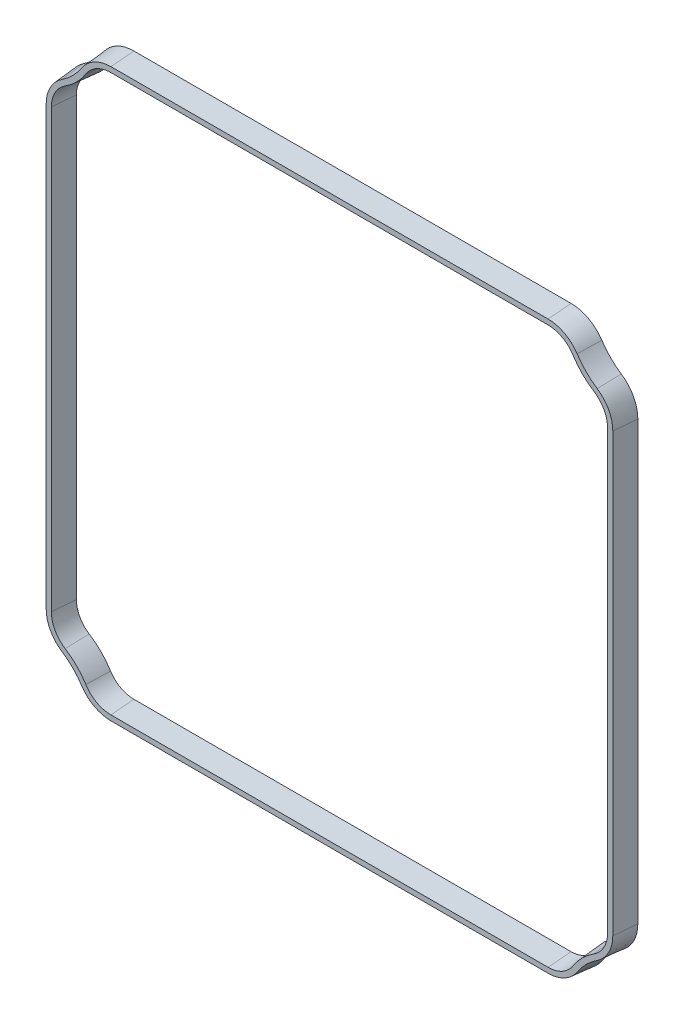
from build123d import *

# Parameters (mm, degrees)
BOSS_EXTRUDE1_DEPTH = 2.5
BOSS_EXTRUDE1_DRAFT = 5


with BuildPart() as part:
    # Sketch1 → Boss-Extrude1 (with draft: the straight prism first)
    with BuildSketch(Plane.XY):
        with BuildLine():
            Line((65.5, 11.25), (65.5, 58.75))
            ThreePointArc((65.5, 58.75), (65.023112089, 60.644117527), (63.706159397, 62.086594179))
            ThreePointArc((63.706159397, 62.086594179), (62.539407406, 63.039407406), (61.586594179, 64.206159397))
            ThreePointArc((61.586594179, 64.206159397), (60.144117527, 65.523112089), (58.25, 66))
            Line((58.25, 66), (10.75, 66))
            ThreePointArc((10.75, 66), (8.855882473, 65.523112089), (7.413405821, 64.206159397))
            ThreePointArc((7.413405821, 64.206159397), (6.460592594, 63.039407406), (5.293840603, 62.086594179))
            ThreePointArc((5.293840603, 62.086594179), (3.976887911, 60.644117527), (3.5, 58.75))
            Line((3.5, 58.75), (3.5, 11.25))
            ThreePointArc((3.5, 11.25), (3.976887911, 9.355882473), (5.293840603, 7.913405821))
            ThreePointArc((5.293840603, 7.913405821), (6.460592594, 6.960592594), (7.413405821, 5.793840603))
            ThreePointArc((7.413405821, 5.793840603), (8.855882473, 4.476887911), (10.75, 4))
            Line((10.75, 4), (58.25, 4))
            ThreePointArc((58.25, 4), (60.144117527, 4.476887911), (61.586594179, 5.793840603))
            ThreePointArc((61.586594179, 5.793840603), (62.539407406, 6.960592594), (63.706159397, 7.913405821))
            ThreePointArc((63.706159397, 7.913405821), (65.023112089, 9.355882473), (65.5, 11.25))
        make_face()
        with BuildLine():
            Line((64.5, 11.25), (64.5, 58.75))
            ThreePointArc((64.5, 58.75), (64.128384354, 60.196235004), (63.105602876, 61.284174304))
            ThreePointArc((63.105602876, 61.284174304), (61.816309207, 62.316309207), (60.784174304, 63.605602876))
            ThreePointArc((60.784174304, 63.605602876), (59.696235004, 64.628384354), (58.25, 65))
            Line((58.25, 65), (10.75, 65))
            ThreePointArc((10.75, 65), (9.303764996, 64.628384354), (8.215825696, 63.605602876))
            ThreePointArc((8.215825696, 63.605602876), (7.183690793, 62.316309207), (5.894397124, 61.284174304))
            ThreePointArc((5.894397124, 61.284174304), (4.871615646, 60.196235004), (4.5, 58.75))
            Line((4.5, 58.75), (4.5, 11.25))
            ThreePointArc((4.5, 11.25), (4.871615646, 9.803764996), (5.894397124, 8.715825696))
            ThreePointArc((5.894397124, 8.715825696), (7.183690793, 7.683690793), (8.215825696, 6.394397124))
            ThreePointArc((8.215825696, 6.394397124), (9.303764996, 5.371615646), (10.75, 5))
            Line((10.75, 5), (58.25, 5))
            ThreePointArc((58.25, 5), (59.696235004, 5.371615646), (60.784174304, 6.394397124))
            ThreePointArc((60.784174304, 6.394397124), (61.816309207, 7.683690793), (63.105602876, 8.715825696))
            ThreePointArc((63.105602876, 8.715825696), (64.128384354, 9.803764996), (64.5, 11.25))
        make_face(mode=Mode.SUBTRACT)
    extrude(amount=BOSS_EXTRUDE1_DEPTH)
    # Boss-Extrude1: the draft: its side faces are tilted about the plane it starts from
    boss_extrude1_sides = [part.faces().sort_by_distance(p)[0] for p in [
        (65.023112089, 9.355882473, 1.25),
        (65.5, 35, 1.25),
        (65.023112089, 60.644117527, 1.25),
        (62.539407406, 63.039407406, 1.25),
        (60.144117527, 65.523112089, 1.25),
        (34.5, 66, 1.25),
        (8.855882473, 65.523112089, 1.25),
        (6.460592594, 63.039407406, 1.25),
        (3.976887911, 60.644117527, 1.25),
        (3.5, 35, 1.25),
        (3.976887911, 9.355882473, 1.25),
        (6.460592594, 6.960592594, 1.25),
        (8.855882473, 4.476887911, 1.25),
        (34.5, 4, 1.25),
        (60.144117527, 4.476887911, 1.25),
        (62.539407406, 6.960592594, 1.25),
        (7.183690793, 7.683690793, 1.25),
        (4.871615646, 9.803764996, 1.25),
        (4.5, 35, 1.25),
        (4.871615646, 60.196235004, 1.25),
        (7.183690793, 62.316309207, 1.25),
        (9.303764996, 64.628384354, 1.25),
        (34.5, 65, 1.25),
        (59.696235004, 64.628384354, 1.25),
        (61.816309207, 62.316309207, 1.25),
        (64.128384354, 60.196235004, 1.25),
        (64.5, 35, 1.25),
        (64.128384354, 9.803764996, 1.25),
        (61.816309207, 7.683690793, 1.25),
        (59.696235004, 5.371615646, 1.25),
        (34.5, 5, 1.25),
        (9.303764996, 5.371615646, 1.25),
    ]]
    draft(boss_extrude1_sides, Plane.XY, BOSS_EXTRUDE1_DRAFT)


solid = part.part
